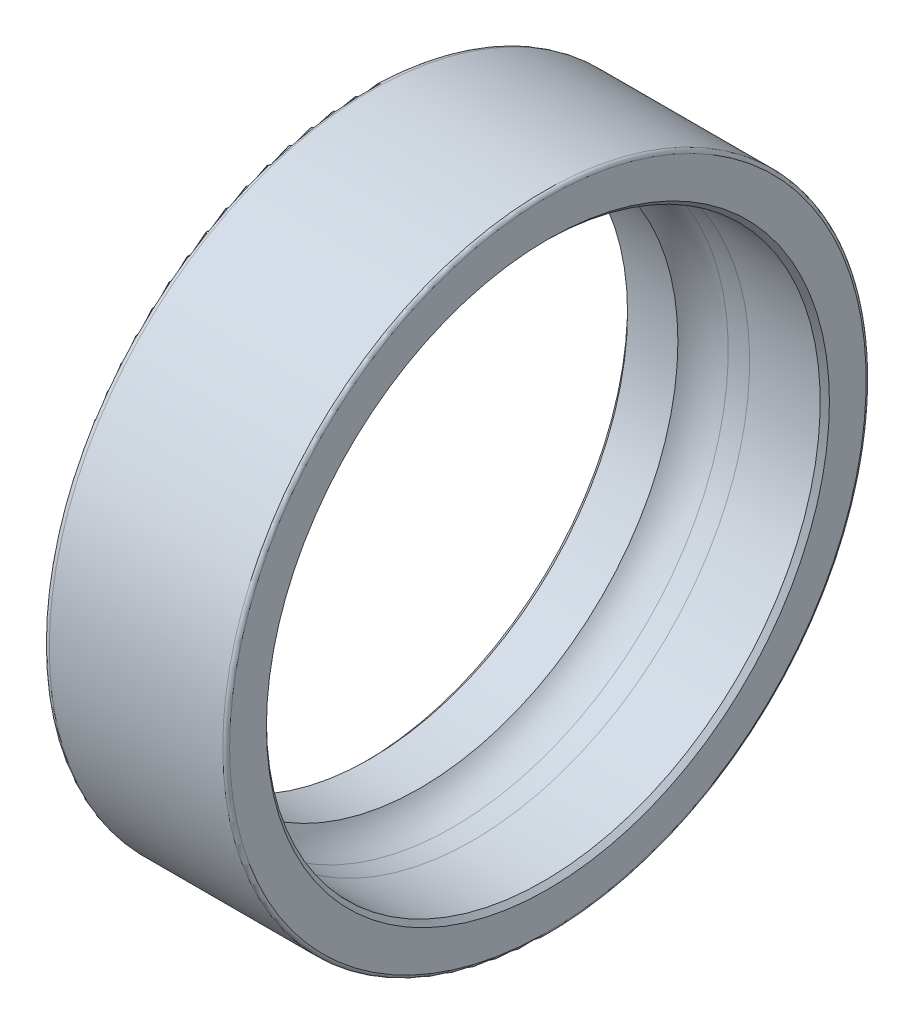
from build123d import *


with BuildPart() as part:
    # Sketch1 → Revolve1 (revolve)
    with BuildSketch(Plane.XY, mode=Mode.PRIVATE) as revolve1_sk:
        with BuildLine():
            Line((-4, 11.465), (-3.76, 11.225))
            Line((-3.76, 11.225), (-1.567918365, 11.225))
            ThreePointArc((-1.567918365, 11.225), (-0.935852777, 11.758477094), (-0.141221865, 11.987968776))
            Line((-0.141221865, 11.987968776), (0.728253065, 12.05))
            Line((0.728253065, 12.05), (3.8, 12.05))
            Line((3.8, 12.05), (4, 12.25))
            Line((4, 12.25), (4, 13.85))
            ThreePointArc((4, 13.85), (3.956066017, 13.956066017), (3.85, 14))
            Line((3.85, 14), (-3.7, 14))
            ThreePointArc((-3.7, 14), (-3.912132034, 13.912132034), (-4, 13.7))
            Line((-4, 13.7), (-4, 11.465))
        make_face()
    revolve(revolve1_sk.sketch.rotate(Axis((4, 0, 0), (-1, 0, 0)), 270), axis=Axis((4, 0, 0), (-1, 0, 0)))


solid = part.part
